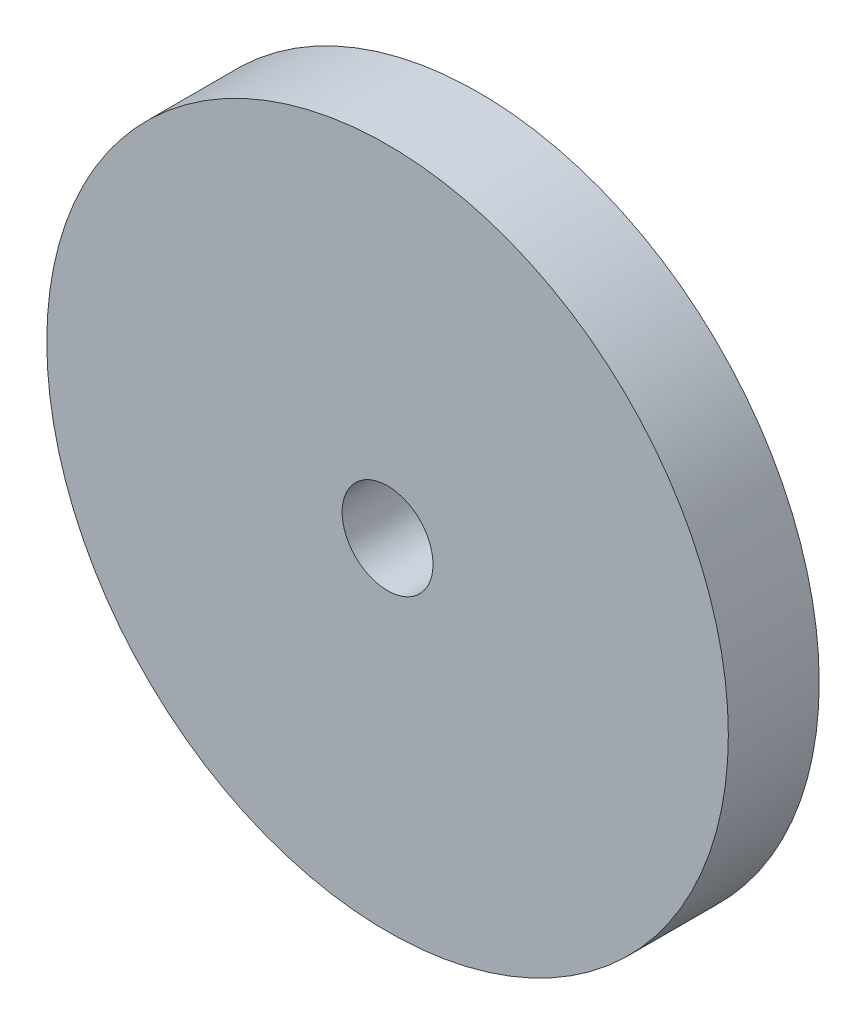
from build123d import *

# Parameters (mm, degrees)
SKETCH2_R           = 7.5
SKETCH2_R_2         = 1
BOSS_EXTRUDE1_DEPTH = 2


with BuildPart() as part:
    # Sketch2 → Boss-Extrude1 (new body)
    with BuildSketch(Plane.XY):
        Circle(SKETCH2_R)
        Circle(SKETCH2_R_2, mode=Mode.SUBTRACT)
    extrude(amount=BOSS_EXTRUDE1_DEPTH)


solid = part.part
